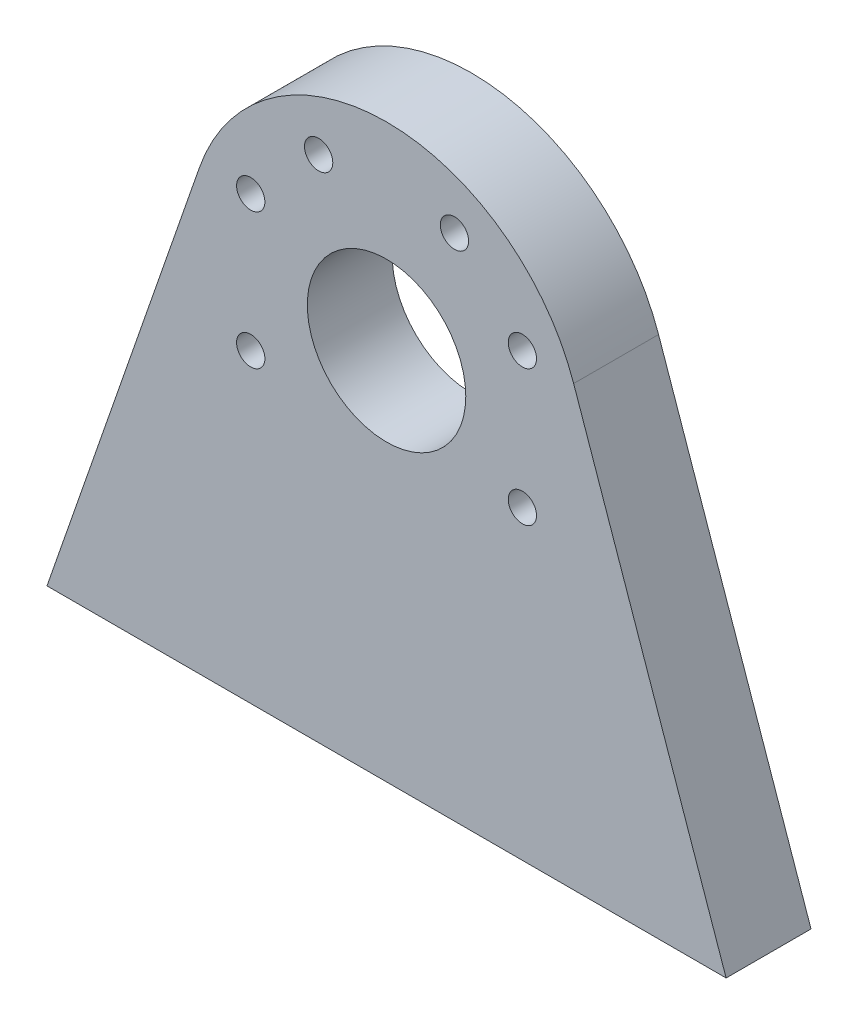
from build123d import *

# Parameters (mm, degrees)
SKETCH_1_R          = 1.25
EXTRUDE_1_DEPTH     = 7.5
SKETCH_2_R          = 1.3
CUT_EXTRUDE_1_DEPTH = 7.5
CHAMFER_1_SIZE      = 0.2


with BuildPart() as part:
    # 草圖1 → 填料-伸長1 (new body)
    with BuildSketch(Plane.XY):
        with BuildLine():
            Line((-30, -33), (0, -33))
            Line((0, -33), (30, -33))
            Line((30, -33), (16.529573398, 5.746581877))
            ThreePointArc((16.529573398, 5.746581877), (0, 17.5), (-16.529573398, 5.746581877))
            Line((-16.529573398, 5.746581877), (-30, -33))
        make_face()
        with Locations((-12, -6)):
            Circle(SKETCH_1_R, mode=Mode.SUBTRACT)
        with BuildLine():
            ThreePointArc((0, -7), (-7, 0), (0, 7))
            ThreePointArc((0, 7), (4.949747468, 4.949747468), (7, 0))
            ThreePointArc((7, 0), (4.949747468, -4.949747468), (0, -7))
        make_face(mode=Mode.SUBTRACT)
        with Locations((-12, 6)):
            Circle(SKETCH_1_R, mode=Mode.SUBTRACT)
        with Locations((-6, 12)):
            Circle(SKETCH_1_R, mode=Mode.SUBTRACT)
        with Locations((12, -6)):
            Circle(SKETCH_1_R, mode=Mode.SUBTRACT)
        with Locations((12, 6)):
            Circle(SKETCH_1_R, mode=Mode.SUBTRACT)
        with Locations((6, 12)):
            Circle(SKETCH_1_R, mode=Mode.SUBTRACT)
    extrude(amount=-EXTRUDE_1_DEPTH)

    # 草圖2 → 除料-伸長1 (cut)
    with BuildSketch(Plane(origin=(0, -33, 0), x_dir=(-1, 0, 0), z_dir=(0, -1, 0))):
        with Locations((-18, 3.75)):
            Circle(SKETCH_2_R)
        with Locations((-6, 3.75)):
            Circle(SKETCH_2_R)
        with Locations((6, 3.75)):
            Circle(SKETCH_2_R)
        with Locations((18, 3.75)):
            Circle(SKETCH_2_R)
    extrude(amount=-CUT_EXTRUDE_1_DEPTH, mode=Mode.SUBTRACT)

    # 導角1
    chamfer_1_edges = [part.edges().sort_by_distance(p)[0] for p in [
        (-16.7, -33, -3.75),
        (-4.7, -33, -3.75),
        (7.3, -33, -3.75),
        (19.3, -33, -3.75),
    ]]
    chamfer(chamfer_1_edges, length=CHAMFER_1_SIZE)


solid = part.part
